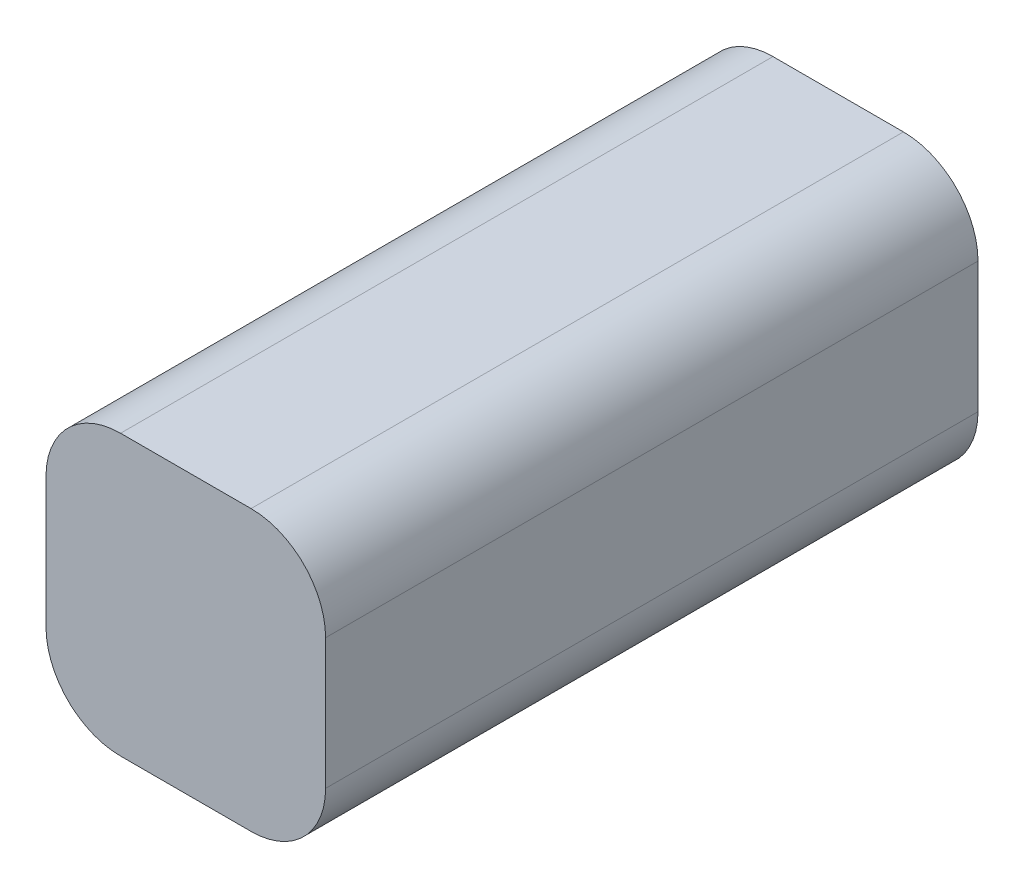
from build123d import *

# Parameters (mm, degrees)
SKETCH1_W           = 381
SKETCH1_H           = 381
BOSS_EXTRUDE1_DEPTH = 889
FILLET1_R           = 101.6


with BuildPart() as part:
    # Sketch1 → Boss-Extrude1 (new body)
    with BuildSketch(Plane.XY):
        Rectangle(SKETCH1_W, SKETCH1_H)
    extrude(amount=BOSS_EXTRUDE1_DEPTH)

    # Fillet1
    fillet1_edges = [part.edges().sort_by_distance(p)[0] for p in [
        (-190.5, 190.5, 444.5),
        (190.5, 190.5, 444.5),
        (190.5, -190.5, 444.5),
        (-190.5, -190.5, 444.5),
    ]]
    fillet(fillet1_edges, radius=FILLET1_R)


solid = part.part
